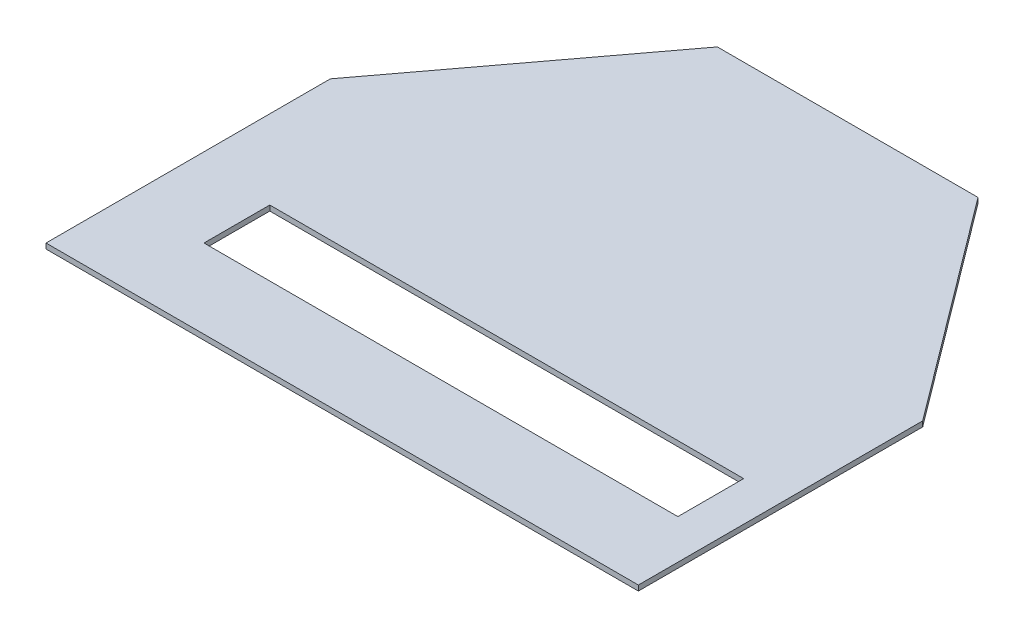
from build123d import *

# Parameters (mm, degrees)
EXTRUDE_1_DEPTH     = 4
CUT_EXTRUDE_1_REACH = 447.081
SKETCH_2_W          = 360
SKETCH_2_H          = 50


with BuildPart() as part:
    # 草图1 → 凸台-拉伸1 (new body)
    with BuildSketch(Plane(origin=(0, 0, 0), x_dir=(1, 0, 0), z_dir=(0, 1, 0))):
        Polygon((-225, 0), (225, 0), (225, 216), (99, 384), (-99, 384), (-225, 216), align=None)
    extrude(amount=EXTRUDE_1_DEPTH)

    # 草图2 → 切除-拉伸1 (cut, up to next)
    with BuildSketch(Plane(origin=(0, 4, 0), x_dir=(1, 0, 0), z_dir=(0, 1, 0)), mode=Mode.PRIVATE) as cut_extrude_1_sk1:
        with Locations((15, 85)):
            Rectangle(SKETCH_2_W, SKETCH_2_H)
    cut_extrude_1_tool1 = extrude(cut_extrude_1_sk1.sketch, amount=-CUT_EXTRUDE_1_REACH, mode=Mode.PRIVATE) & part.part
    add(cut_extrude_1_tool1.solids().sort_by_distance((15, 4, -85))[0], mode=Mode.SUBTRACT)


solid = part.part
